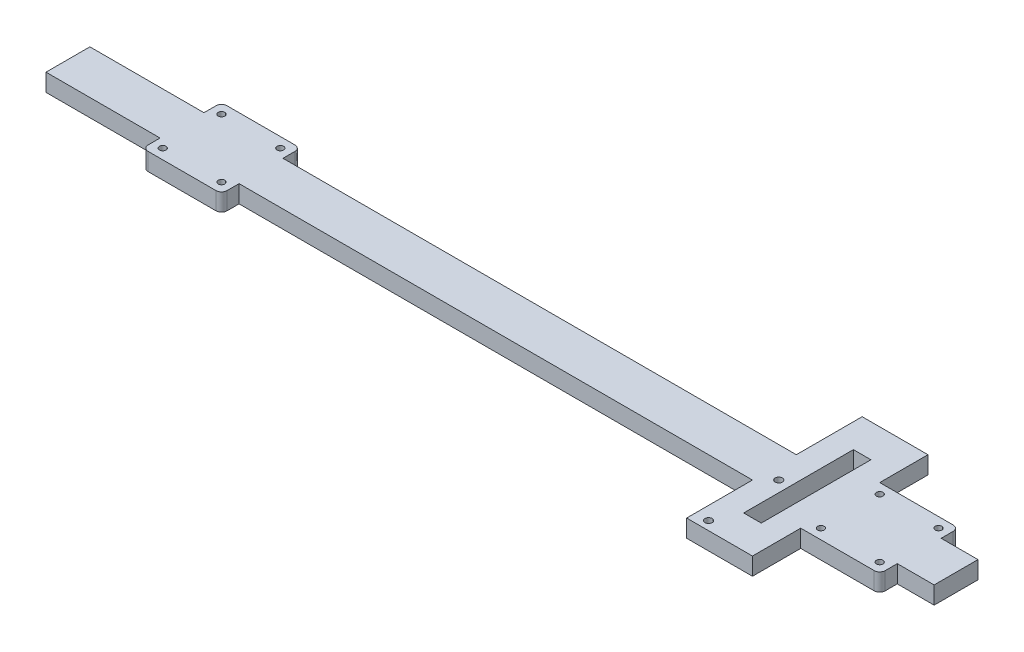
from build123d import *

# Parameters (mm, degrees)
SKETCH1_W           = 70
SKETCH1_H           = 20
SKETCH1_W_2         = 264.8
EXTRUDE_931_DEPTH   = 8
SKETCH2_W           = 36
SKETCH2_H           = 8
BOSS_EXTRUDE2_DEPTH = 8
SKETCH4_W           = 36
SKETCH4_H           = 8
BOSS_EXTRUDE3_DEPTH = 8
SKETCH5_R           = 1.5
CUT_EXTRUDE1_DEPTH  = 349.438631613
FILLET1_R           = 2.5
SKETCH6_W           = 30
SKETCH6_H           = 8
BOSS_EXTRUDE4_DEPTH = 30
SKETCH7_W           = 30
SKETCH7_H           = 8
BOSS_EXTRUDE5_DEPTH = 30
SKETCH8_W           = 8
SKETCH8_H           = 50
CUT_EXTRUDE2_DEPTH  = 356.142619239
SKETCH11_R          = 1.65
CUT_EXTRUDE3_DEPTH  = 356.142619239


with BuildPart() as part:
    # Sketch1 → Extrude 931 (new body)
    with BuildSketch(Plane(origin=(0, 0, 0), x_dir=(1, 0, 0), z_dir=(0, 1, 0))):
        with Locations((-35, -78.2)):
            Rectangle(SKETCH1_W, SKETCH1_H)
        with Locations((132.4, -78.2)):
            Rectangle(SKETCH1_W_2, SKETCH1_H)
        with Locations((299.8, -78.2)):
            Rectangle(SKETCH1_W, SKETCH1_H)
    extrude(amount=EXTRUDE_931_DEPTH)

    # Sketch2 → Boss-Extrude2 (add)
    with BuildSketch(Plane(origin=(0, 0, 68.2), x_dir=(-1, 0, 0), z_dir=(0, 0, -1))):
        with Locations((0, 4)):
            Rectangle(SKETCH2_W, SKETCH2_H)
        with Locations((-300, 4)):
            Rectangle(SKETCH2_W, SKETCH2_H)
    extrude(amount=BOSS_EXTRUDE2_DEPTH)

    # Sketch4 → Boss-Extrude3 (add)
    with BuildSketch(Plane.XY.offset(88.2)):
        with Locations((0, 4)):
            Rectangle(SKETCH4_W, SKETCH4_H)
        with Locations((300, 4)):
            Rectangle(SKETCH4_W, SKETCH4_H)
    extrude(amount=BOSS_EXTRUDE3_DEPTH)

    # Sketch5 → Cut-Extrude1 (cut, through all)
    with BuildSketch(Plane(origin=(0, 8, 0), x_dir=(1, 0, 0), z_dir=(0, 1, 0))):
        with Locations(Location((-13.4, -91.6, 0), (0, 0, 270))):
            Circle(SKETCH5_R)
        with Locations(Location((13.4, -91.6, 0), (0, 0, 270))):
            Circle(SKETCH5_R)
        with Locations(Location((13.4, -64.8, 0), (0, 0, 270))):
            Circle(SKETCH5_R)
        with Locations(Location((-13.4, -64.8, 0), (0, 0, 270))):
            Circle(SKETCH5_R)
        with Locations(Location((313.4, -91.6, 0), (0, 0, 270))):
            Circle(SKETCH5_R)
        with Locations(Location((286.6, -64.8, 0), (0, 0, 270))):
            Circle(SKETCH5_R)
        with Locations(Location((313.4, -64.8, 0), (0, 0, 270))):
            Circle(SKETCH5_R)
        with Locations(Location((286.6, -91.6, 0), (0, 0, 270))):
            Circle(SKETCH5_R)
    extrude(amount=-CUT_EXTRUDE1_DEPTH, mode=Mode.SUBTRACT)

    # Fillet1
    fillet1_edges = [part.edges().sort_by_distance(p)[0] for p in [
        (-18, 4, 60.2),
        (18, 4, 60.2),
        (318, 4, 60.2),
        (18, 4, 96.2),
        (-18, 4, 96.2),
        (318, 4, 96.2),
    ]]
    fillet(fillet1_edges, radius=FILLET1_R)

    # Sketch6 → Boss-Extrude4 (add)
    with BuildSketch(Plane.XY.offset(88.2)):
        with Locations((267, 4)):
            Rectangle(SKETCH6_W, SKETCH6_H)
    extrude(amount=BOSS_EXTRUDE4_DEPTH)

    # Sketch7 → Boss-Extrude5 (add)
    with BuildSketch(Plane(origin=(0, 0, 68.2), x_dir=(-1, 0, 0), z_dir=(0, 0, -1))):
        with Locations((-267, 4)):
            Rectangle(SKETCH7_W, SKETCH7_H)
    extrude(amount=BOSS_EXTRUDE5_DEPTH)

    # Sketch8 → Cut-Extrude2 (cut, through all)
    with BuildSketch(Plane(origin=(0, 8, 0), x_dir=(1, 0, 0), z_dir=(0, 1, 0))):
        with Locations((267, -78.2)):
            Rectangle(SKETCH8_W, SKETCH8_H)
    extrude(amount=-CUT_EXTRUDE2_DEPTH, mode=Mode.SUBTRACT)

    # Sketch11 → Cut-Extrude3 (cut, through all)
    with BuildSketch(Plane(origin=(0, 8, 0), x_dir=(1, 0, 0), z_dir=(0, 1, 0))):
        with Locations(Location((258, -114.2, 0), (0, 0, 270))):
            Circle(SKETCH11_R)
        with Locations(Location((258, -82.2, 0), (0, 0, 270))):
            Circle(SKETCH11_R)
    extrude(amount=-CUT_EXTRUDE3_DEPTH, mode=Mode.SUBTRACT)


solid = part.part
